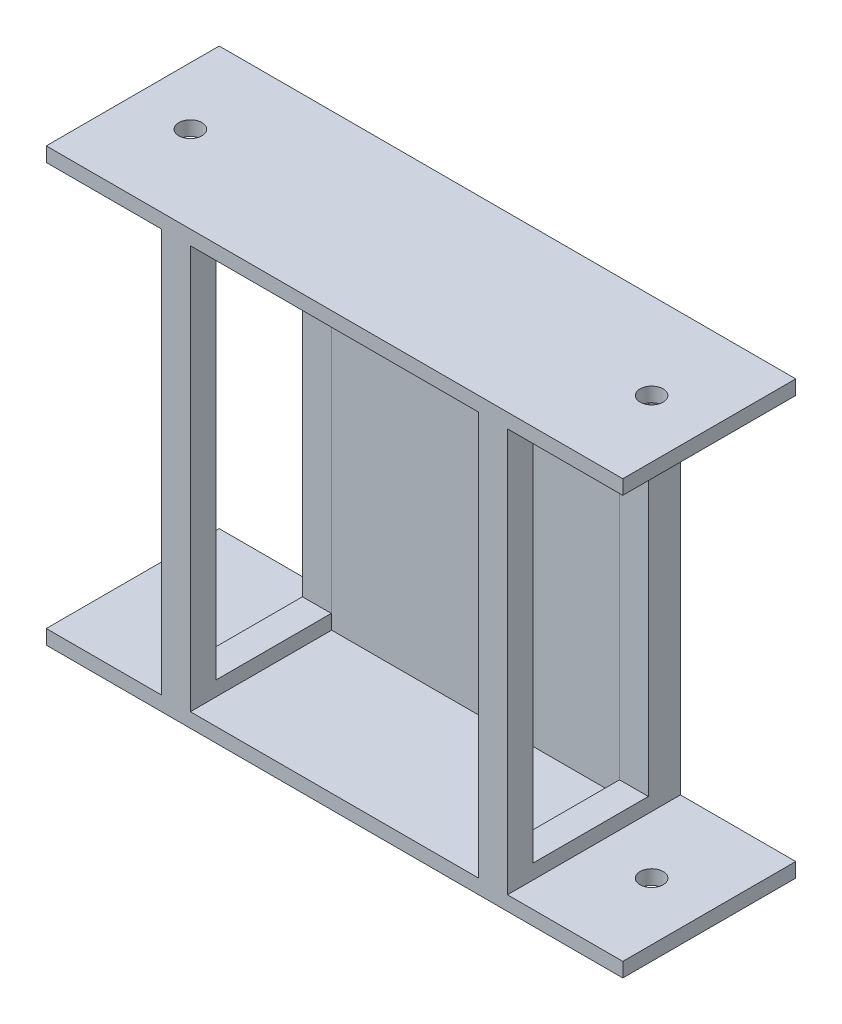
from build123d import *

# Parameters (mm, degrees)
EXTRUDE_1_DEPTH     = 60
SKETCH_2_W          = 40
SKETCH_2_H          = 130
CUT_EXTRUDE_1_DEPTH = 136
SKETCH_3_W          = 100
SKETCH_3_H          = 140
CUT_EXTRUDE_2_DEPTH = 49
SKETCH_4_R          = 4
CUT_EXTRUDE_3_DEPTH = 198


with BuildPart() as part:
    # 草图1 → 凸台-拉伸1 (new body)
    with BuildSketch(Plane.XY):
        Polygon((-100, 75), (100, 75), (100, 70), (60, 70), (60, -70), (100, -70), (100, -75), (-100, -75), (-100, -70), (-60, -70), (-60, 70), (-100, 70), align=None)
    extrude(amount=EXTRUDE_1_DEPTH)

    # 草图2 → 切除-拉伸1 (cut)
    with BuildSketch(Plane(origin=(60, 0, 0), x_dir=(0, 0, -1), z_dir=(1, 0, 0))):
        with Locations((-31.130418395, 0.098831956)):
            Rectangle(SKETCH_2_W, SKETCH_2_H)
    extrude(amount=-CUT_EXTRUDE_1_DEPTH, mode=Mode.SUBTRACT)

    # 草图3 → 切除-拉伸2 (cut)
    with BuildSketch(Plane.XY.offset(60)):
        Rectangle(SKETCH_3_W, SKETCH_3_H)
    extrude(amount=-CUT_EXTRUDE_2_DEPTH, mode=Mode.SUBTRACT)

    # 草图4 → 切除-拉伸3 (cut)
    with BuildSketch(Plane.XZ.offset(75)):
        with Locations(Location((-80, 30, 0), (0, 0, 270))):
            Circle(SKETCH_4_R)
        with Locations(Location((80, 30, 0), (0, 0, 270))):
            Circle(SKETCH_4_R)
    extrude(amount=-CUT_EXTRUDE_3_DEPTH, mode=Mode.SUBTRACT)


solid = part.part
